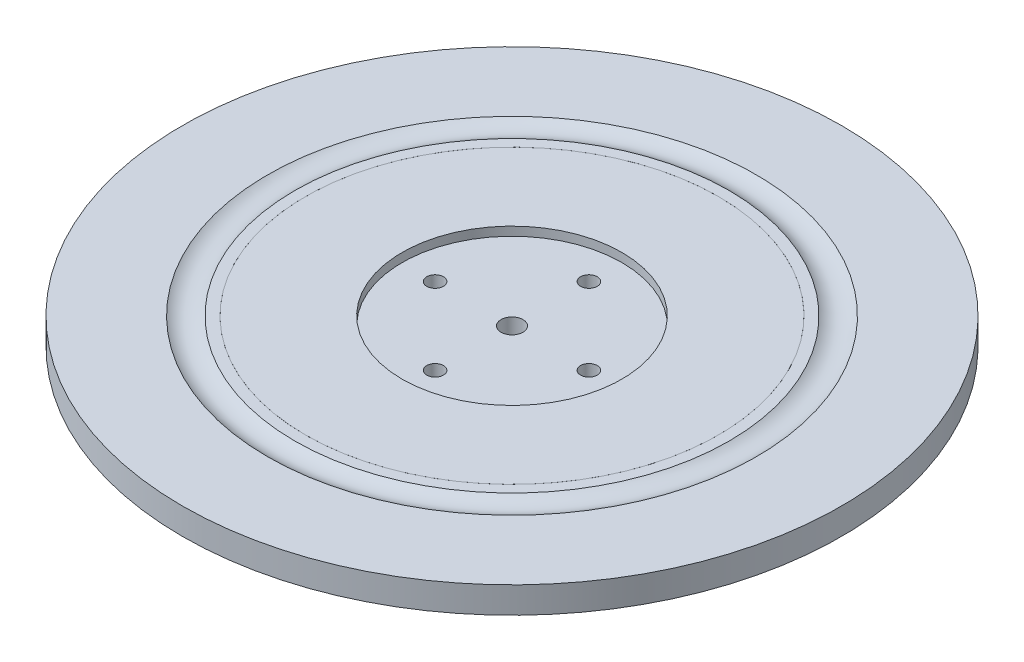
from build123d import *

# Parameters (mm, degrees)
SKETCH2_R           = 75
SKETCH2_R_2         = 59
SKETCH2_R_3         = 46.992946112
BOSS_EXTRUDE1_DEPTH = 6
SKETCH4_R           = 2.5
CUT_EXTRUDE1_DEPTH  = 8
SKETCH5_R           = 1.9
CUT_EXTRUDE2_DEPTH  = 8
SKETCH8_R           = 25
CUT_EXTRUDE4_DEPTH  = 2


with BuildPart() as part:
    # Sketch1 → Revolve1 (revolve)
    with BuildSketch(Plane(origin=(0, 0, 0), x_dir=(-1, 0, 0), z_dir=(0, 0, -1)), mode=Mode.PRIVATE) as revolve1_sk:
        with BuildLine():
            Line((-59, 0.8724), (-47, 0.8724))
            ThreePointArc((-47, 0.8724), (-46.292893219, 1.165293219), (-46, 1.8724))
            Line((-46, 1.8724), (-46, 5.8724))
            Line((-46, 5.8724), (-47, 6.8724))
            Line((-47, 6.8724), (-49.4043, 6.8724))
            ThreePointArc((-49.4043, 6.8724), (-52.5, 5.8405), (-55.5957, 6.8724))
            Line((-55.5957, 6.8724), (-59, 6.8724))
            Line((-59, 6.8724), (-60, 5.8724))
            Line((-60, 5.8724), (-60, 1.8724))
            ThreePointArc((-60, 1.8724), (-59.707106781, 1.165293219), (-59, 0.8724))
        make_face()
    revolve(revolve1_sk.sketch.rotate(Axis((0, 0, 0), (0, 1, 0)), 270), axis=Axis((0, 0, 0), (0, 1, 0)))

    # Sketch2 → Boss-Extrude1 (add)
    # profile 1 of 2: a face of its own
    with BuildSketch(Plane.XZ.offset(-0.8724)):
        with Locations(Location((0, 0, 0), (0, 0, 270))):
            Circle(SKETCH2_R)
        Circle(SKETCH2_R_2, mode=Mode.SUBTRACT)
    # profile 2 of 2: a face of its own
    with BuildSketch(Plane.XZ.offset(-0.8724)):
        with Locations(Location((0, 0, 0), (0, 0, 270))):
            Circle(SKETCH2_R_3)
    extrude(amount=-BOSS_EXTRUDE1_DEPTH)

    # Sketch4 → Cut-Extrude1 (cut)
    with BuildSketch(Plane.XZ.offset(-0.8724)):
        with Locations(Location((0, 0, 0), (0, 0, 270))):
            Circle(SKETCH4_R)
    extrude(amount=-CUT_EXTRUDE1_DEPTH, mode=Mode.SUBTRACT)

    # Sketch5 → Cut-Extrude2 (cut)
    with BuildSketch(Plane.XZ.offset(-0.8724)):
        with Locations(Location((0, 17.5, 0), (0, 0, 270))):
            Circle(SKETCH5_R)
        with Locations(Location((17.5, 0, 0), (0, 0, 270))):
            Circle(SKETCH5_R)
        with Locations(Location((0, -17.5, 0), (0, 0, 270))):
            Circle(SKETCH5_R)
        with Locations(Location((-17.5, 0, 0), (0, 0, 270))):
            Circle(SKETCH5_R)
    extrude(amount=-CUT_EXTRUDE2_DEPTH, mode=Mode.SUBTRACT)

    # Sketch8 → Cut-Extrude4 (cut)
    with BuildSketch(Plane(origin=(0, 6.8724, 0), x_dir=(1, 0, 0), z_dir=(0, 1, 0))):
        with Locations(Location((0, 0, 0), (0, 0, 270))):
            Circle(SKETCH8_R)
    extrude(amount=-CUT_EXTRUDE4_DEPTH, mode=Mode.SUBTRACT)


solid = part.part
